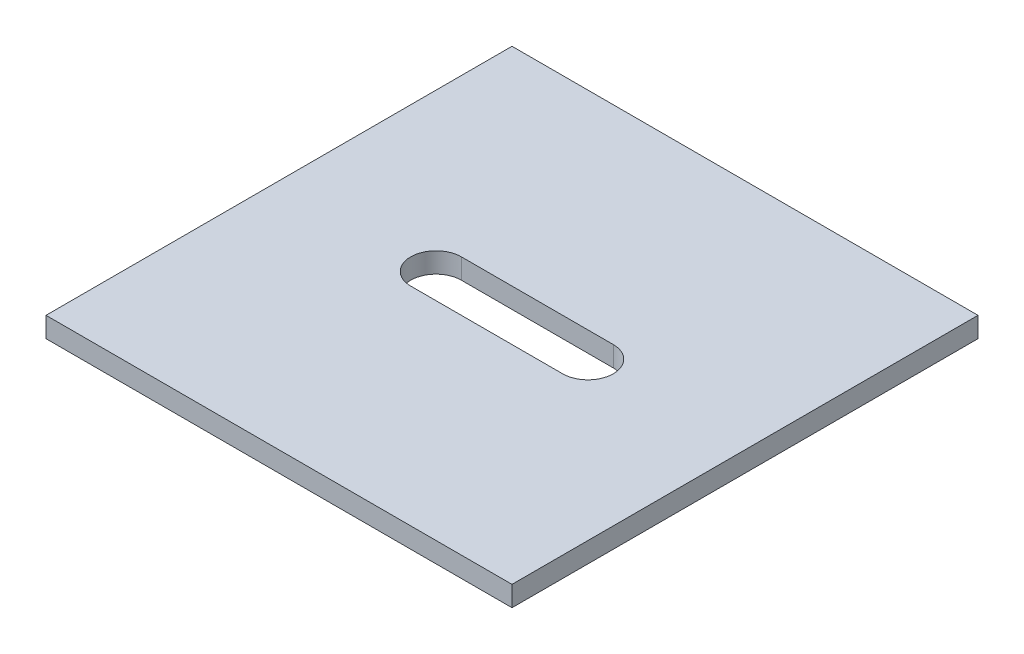
from build123d import *

# Parameters (mm, degrees)
SKETCH2_W           = 276
SKETCH2_H           = 276
BOSS_EXTRUDE1_DEPTH = 12
CUT_EXTRUDE1_DEPTH  = 12


with BuildPart() as part:
    # Sketch2 → Boss-Extrude1 (new body)
    with BuildSketch(Plane(origin=(0, 0, 0), x_dir=(1, 0, 0), z_dir=(0, 1, 0))):
        with Locations((138, 138)):
            Rectangle(SKETCH2_W, SKETCH2_H)
    extrude(amount=BOSS_EXTRUDE1_DEPTH)

    # Sketch2<3> → Cut-Extrude1 (cut)
    with BuildSketch(Plane(origin=(0, 0, 0), x_dir=(1, 0, 0), z_dir=(0, 1, 0))):
        with BuildLine():
            Line((93, 153), (183, 153))
            ThreePointArc((183, 153), (198, 138), (183, 123))
            Line((183, 123), (93, 123))
            ThreePointArc((93, 123), (78, 138), (93, 153))
        make_face()
    extrude(amount=CUT_EXTRUDE1_DEPTH, mode=Mode.SUBTRACT)


solid = part.part
